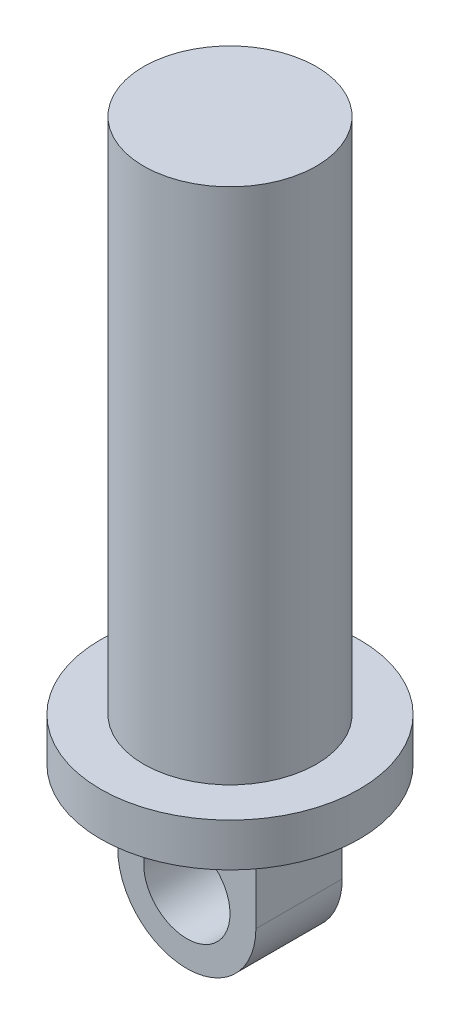
from build123d import *

# Parameters (mm, degrees)
SKETCH1_R           = 2.5
BOSS_EXTRUDE1_DEPTH = 2.5
SKETCH2_R           = 7.5
BOSS_EXTRUDE2_DEPTH = 2.5
SKETCH3_R           = 5
BOSS_EXTRUDE3_DEPTH = 30


with BuildPart() as part:
    # Sketch1 → Boss-Extrude1 (new, symmetric)
    with BuildSketch(Plane.XY):
        with BuildLine():
            Line((-4, 0), (-4, 5))
            Line((-4, 5), (4, 5))
            Line((4, 5), (4, 0))
            ThreePointArc((4, 0), (0, -4), (-4, 0))
        make_face()
        Circle(SKETCH1_R, mode=Mode.SUBTRACT)
    extrude(amount=BOSS_EXTRUDE1_DEPTH, both=True)

    # Sketch2 → Boss-Extrude2 (add)
    with BuildSketch(Plane(origin=(0, 5, 0), x_dir=(1, 0, 0), z_dir=(0, 1, 0))):
        with Locations(Location((0, 0, 0), (0, 0, 270))):
            Circle(SKETCH2_R)
    extrude(amount=BOSS_EXTRUDE2_DEPTH)

    # Sketch3 → Boss-Extrude3 (add)
    with BuildSketch(Plane(origin=(0, 7.5, 0), x_dir=(1, 0, 0), z_dir=(0, 1, 0))):
        with Locations(Location((0, 0, 0), (0, 0, 270))):
            Circle(SKETCH3_R)
    extrude(amount=BOSS_EXTRUDE3_DEPTH)


solid = part.part
